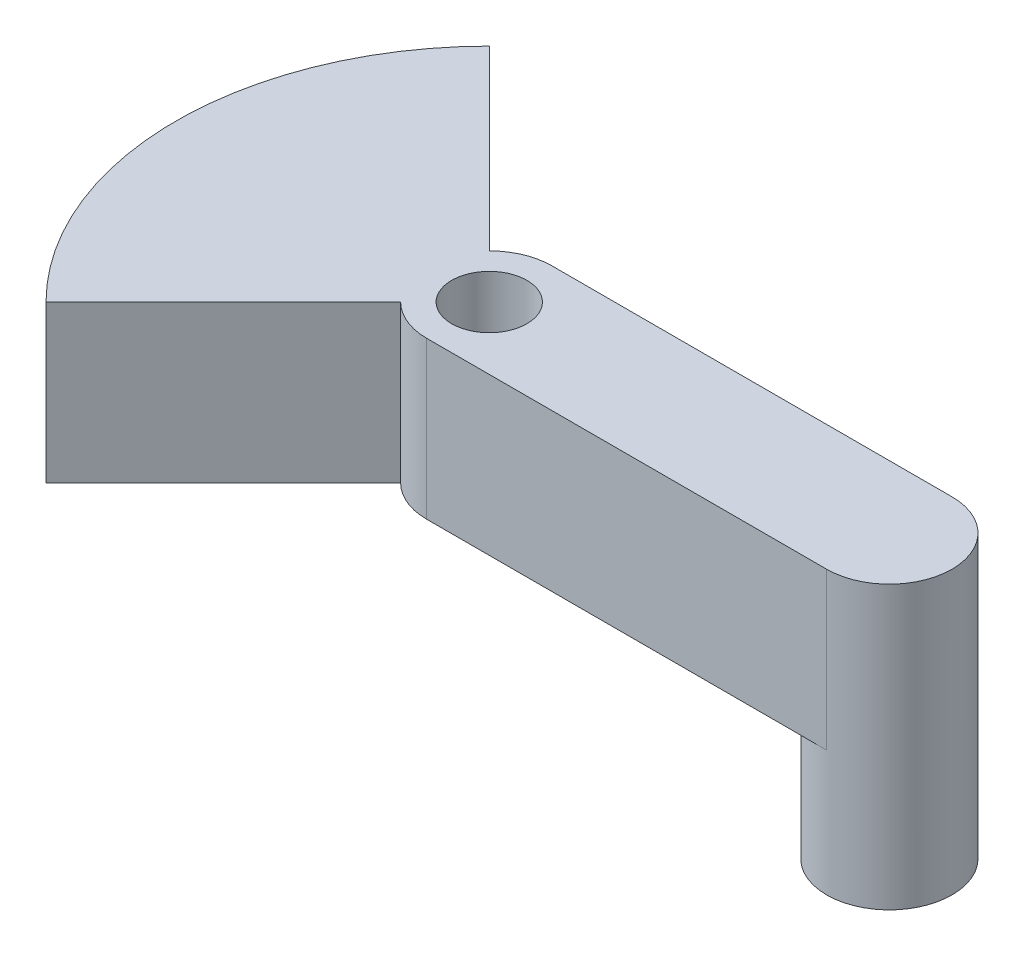
from build123d import *

# Parameters (mm, degrees)
SKETCH_2_R           = 6
EXTRUDE_1_DEPTH      = 25
EXTRUDE_2_DEPTH      = 25
EXTRUDE_2_DEPTH_BACK = 20
SKETCH_2_3_R         = 10
EXTRUDE_START        = -25
EXTRUDE_3_DEPTH      = 25


with BuildPart() as part:
    # 草图2 → 凸台-拉伸1 (new body)
    with BuildSketch(Plane(origin=(0, 0, 0), x_dir=(1, 0, 0), z_dir=(0, 1, 0))):
        with BuildLine():
            ThreePointArc((0, 10), (-4.694715628, 8.829475929), (-8.290375726, 5.591929035))
            Line((-8.290375726, 5.591929035), (-41.451878628, 27.959645174))
            ThreePointArc((-41.451878628, 27.959645174), (-50, 0), (-41.451878628, -27.959645174))
            Line((-41.451878628, -27.959645174), (-8.290375726, -5.591929035))
            ThreePointArc((-8.290375726, -5.591929035), (-4.694715628, -8.829475929), (0, -10))
            Line((0, -10), (63.82, -10))
            ThreePointArc((63.82, -10), (53.82, 0), (63.82, 10))
            Line((63.82, 10), (0, 10))
        make_face()
        Circle(SKETCH_2_R, mode=Mode.SUBTRACT)
    extrude(amount=EXTRUDE_1_DEPTH)

    # 草图2<3> → 凸台-拉伸2 (add, two sides: drawn at the far end of the back side and taken through both)
    with BuildSketch(Plane(origin=(0, 0, 0), x_dir=(1, 0, 0), z_dir=(0, 1, 0)).offset(-EXTRUDE_2_DEPTH_BACK)):
        with Locations((63.82, 0)):
            Circle(SKETCH_2_3_R)
    extrude(amount=EXTRUDE_2_DEPTH + EXTRUDE_2_DEPTH_BACK)

    # 草图3 → 凸台-拉伸3 (add)
    with BuildSketch(Plane(origin=(0, 25, 0), x_dir=(1, 0, 0), z_dir=(0, 1, 0)).offset(EXTRUDE_START)):
        with BuildLine():
            ThreePointArc((-8.290375726, 5.591929035), (-7.716245834, 6.360782203), (-7.071067812, 7.071067812))
            Line((-7.071067812, 7.071067812), (-35.355339059, 35.355339059))
            ThreePointArc((-35.355339059, 35.355339059), (-38.581229169, 31.803911014), (-41.451878628, 27.959645174))
            Line((-41.451878628, 27.959645174), (-8.290375726, 5.591929035))
        make_face()
        with BuildLine():
            Line((-35.355339059, -35.355339059), (-7.071067812, -7.071067812))
            ThreePointArc((-7.071067812, -7.071067812), (-7.716245834, -6.360782203), (-8.290375726, -5.591929035))
            Line((-8.290375726, -5.591929035), (-41.451878628, -27.959645174))
            ThreePointArc((-41.451878628, -27.959645174), (-38.581229169, -31.803911014), (-35.355339059, -35.355339059))
        make_face()
    extrude(amount=EXTRUDE_3_DEPTH)


solid = part.part
